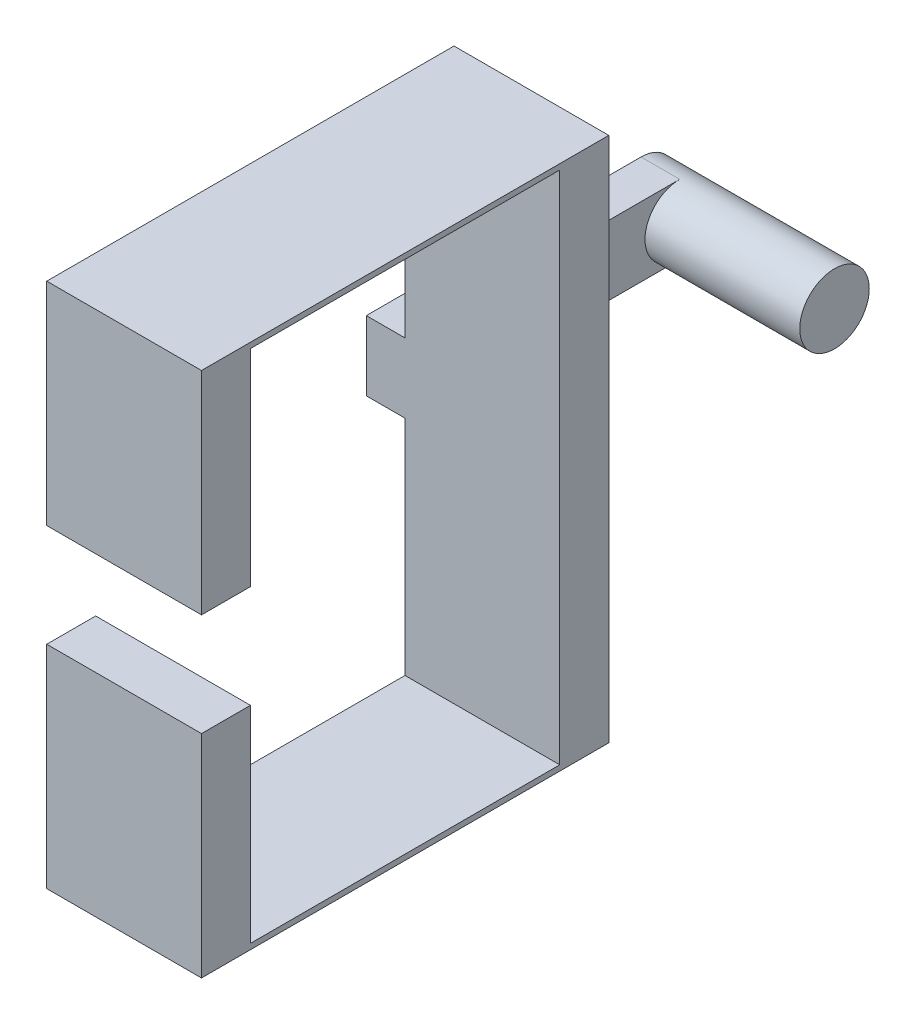
from build123d import *

# Parameters (mm, degrees)
BOSS_EXTRUDE1_DEPTH = 19.05
SKETCH2_W           = 8.554162714
SKETCH2_H           = 38.1
BOSS_EXTRUDE2_DEPTH = 4.763405733
SKETCH3_R           = 4.277081357
BOSS_EXTRUDE3_DEPTH = 19.05
CUT_EXTRUDE1_REACH  = 86.087
CUT_EXTRUDE2_REACH  = 86.087


with BuildPart() as part:
    # Sketch1 → Boss-Extrude1 (new body)
    with BuildSketch(Plane.YZ):
        Polygon((0, 0), (0, 50.133536148), (26.05701333, 50.133536148), (26.05701333, 44.11057508), (0.67733333, 44.11057508), (0.67733333, 6.03597508), (64.08589333, 6.03597508), (64.08589333, 44.11057508), (38.70621333, 44.11057508), (38.70621333, 50.133536148), (64.76322666, 50.133536148), (64.76322666, 0), align=None)
    extrude(amount=BOSS_EXTRUDE1_DEPTH)

    # Sketch2 → Boss-Extrude2 (add)
    with BuildSketch(Plane(origin=(0, 0, 0), x_dir=(0, -1, 0), z_dir=(-1, 0, 0))):
        with Locations((-32.38161333, -13.01402492)):
            Rectangle(SKETCH2_W, SKETCH2_H)
    extrude(amount=BOSS_EXTRUDE2_DEPTH)

    # Sketch3 → Boss-Extrude3 (add)
    with BuildSketch(Plane.YZ):
        with Locations(Location((32.38161333, -27.786943563, 0), (0, 0, 270))):
            Circle(SKETCH3_R)
    extrude(amount=BOSS_EXTRUDE3_DEPTH)

    # Sketch5 → Cut-Extrude1 (cut, up to next)
    with BuildSketch(Plane.YZ, mode=Mode.PRIVATE) as cut_extrude1_sk1:
        with BuildLine():
            Line((32.38161333, -32.06402492), (36.658694687, -32.06402492))
            Line((36.658694687, -32.06402492), (36.658694687, -27.786943563))
            ThreePointArc((36.658694687, -27.786943563), (35.405966561, -30.811296794), (32.38161333, -32.06402492))
        make_face()
    cut_extrude1_tool1 = extrude(cut_extrude1_sk1.sketch, amount=-CUT_EXTRUDE1_REACH, mode=Mode.PRIVATE) & part.part
    add(cut_extrude1_tool1.solids().sort_by_distance((0, 35.703332, -31.108662))[0], mode=Mode.SUBTRACT)

    # Sketch6 → Cut-Extrude2 (cut, up to next)
    with BuildSketch(Plane.YZ, mode=Mode.PRIVATE) as cut_extrude2_sk1:
        with BuildLine():
            Line((28.104531973, -27.786943563), (28.104531973, -32.06402492))
            Line((28.104531973, -32.06402492), (32.38161333, -32.06402492))
            ThreePointArc((32.38161333, -32.06402492), (29.357260099, -30.811296794), (28.104531973, -27.786943563))
        make_face()
    cut_extrude2_tool1 = extrude(cut_extrude2_sk1.sketch, amount=-CUT_EXTRUDE2_REACH, mode=Mode.PRIVATE) & part.part
    add(cut_extrude2_tool1.solids().sort_by_distance((0, 29.059895, -31.108662))[0], mode=Mode.SUBTRACT)


solid = part.part
